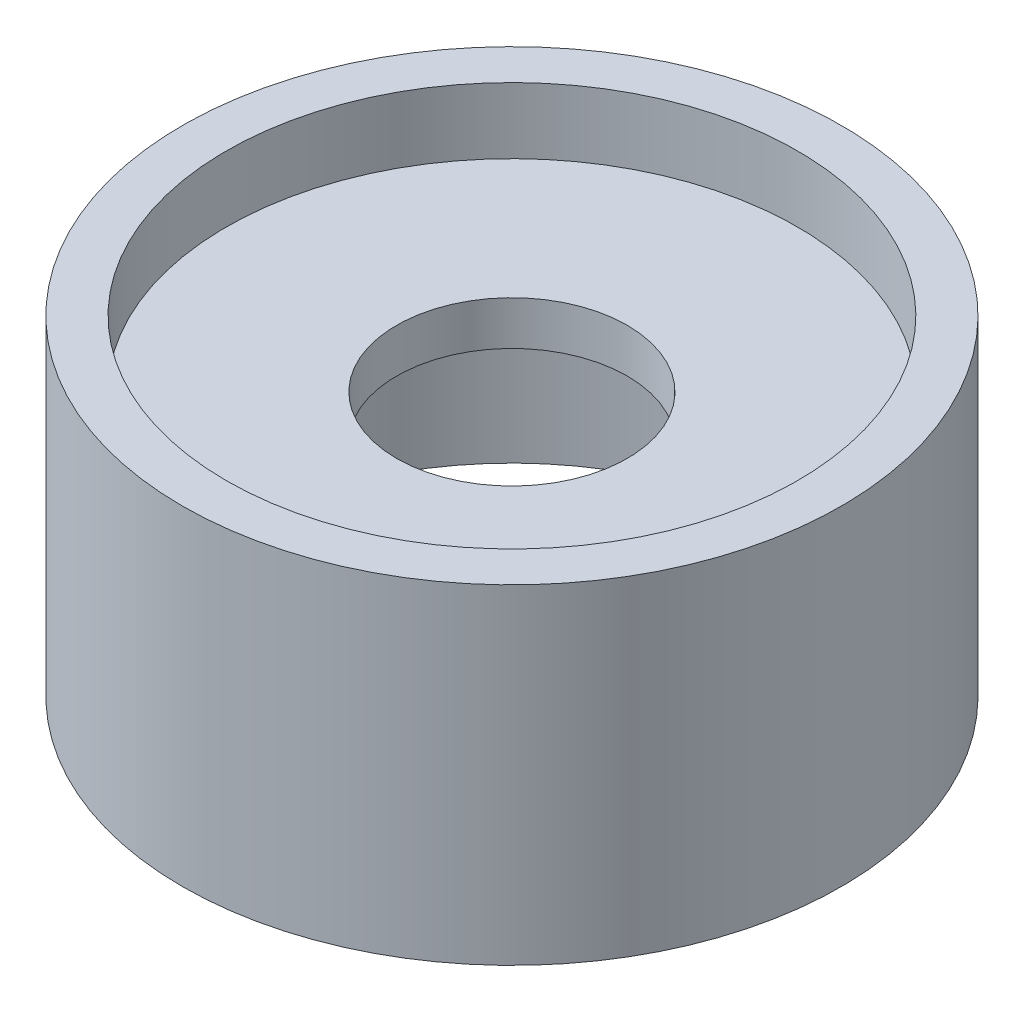
from build123d import *

# Parameters (mm, degrees)
BOSS_EXTRUDE1_DEPTH      = 5
BOSS_EXTRUDE1_DEPTH_BACK = 10
SKETCH1_R                = 15
SKETCH1_R_2              = 13
SKETCH2_R                = 15
BOSS_EXTRUDE2_DEPTH      = 2
CUT_EXTRUDE1_DEPTH       = 24.452078799
CUT_EXTRUDE1_DEPTH_BACK  = 24.452078799
SKETCH3_R                = 5.25


with BuildPart() as part:
    # Sketch1 → Boss-Extrude1 (new, two sides: drawn at the far end of the back side and taken through both)
    with BuildSketch(Plane(origin=(0, 0, 0), x_dir=(1, 0, 0), z_dir=(0, 1, 0)).offset(-BOSS_EXTRUDE1_DEPTH_BACK)):
        with Locations(Location((0, 0, 0), (0, 0, 270))):
            Circle(SKETCH1_R)
        with Locations(Location((0, 0, 0), (0, 0, 270))):
            Circle(SKETCH1_R_2, mode=Mode.SUBTRACT)
    extrude(amount=BOSS_EXTRUDE1_DEPTH + BOSS_EXTRUDE1_DEPTH_BACK)

    # Sketch2 → Boss-Extrude2 (add)
    with BuildSketch(Plane(origin=(0, 0, 0), x_dir=(1, 0, 0), z_dir=(0, 1, 0))):
        with Locations(Location((0, 0, 0), (0, 0, 270))):
            Circle(SKETCH2_R)
    extrude(amount=BOSS_EXTRUDE2_DEPTH)

    # Sketch3 → Cut-Extrude1 (cut, two sides: drawn at the far end of the back side and taken through both)
    with BuildSketch(Plane(origin=(0, 0, 0), x_dir=(1, 0, 0), z_dir=(0, 1, 0)).offset(-CUT_EXTRUDE1_DEPTH_BACK)):
        with Locations(Location((0, 0, 0), (0, 0, 270))):
            Circle(SKETCH3_R)
    extrude(amount=CUT_EXTRUDE1_DEPTH + CUT_EXTRUDE1_DEPTH_BACK, mode=Mode.SUBTRACT)


solid = part.part
